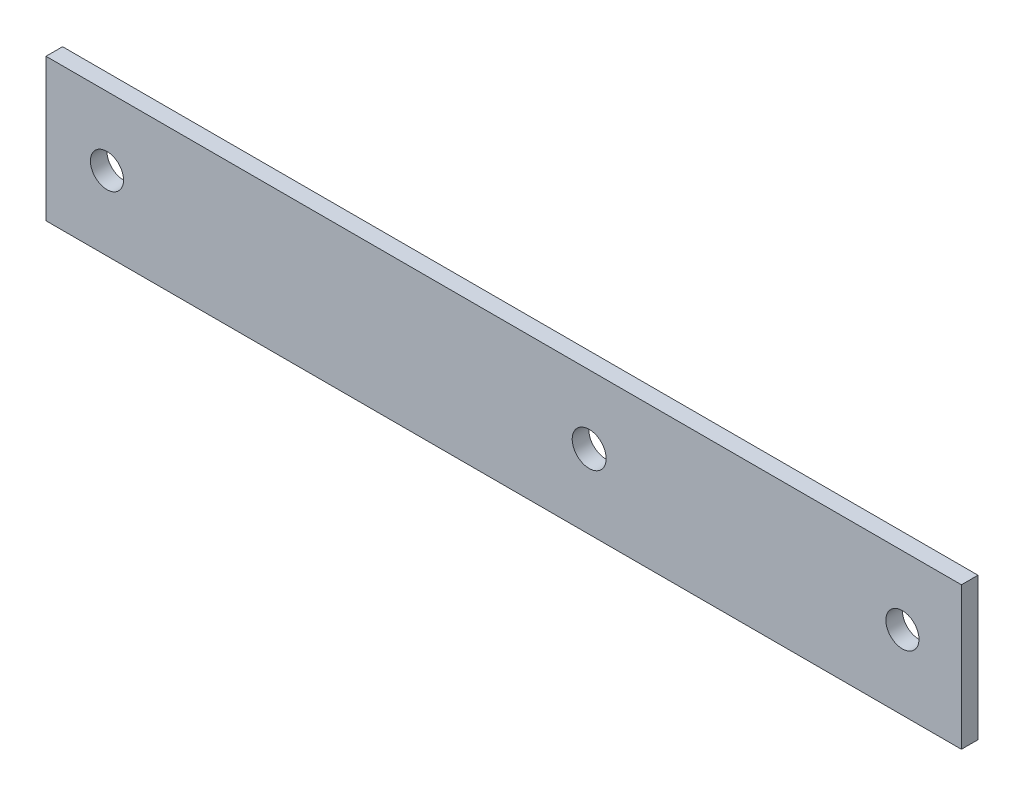
from build123d import *

# Parameters (mm, degrees)
SKETCH1_W           = 175.390705646
SKETCH1_H           = 27.302162023
SKETCH1_R           = 3.175
SKETCH1_R_2         = 3.2512
BOSS_EXTRUDE1_DEPTH = 3.175


with BuildPart() as part:
    # Sketch1 → Boss-Extrude1 (new body)
    with BuildSketch(Plane.XY):
        with Locations((152.213731171, -0.53297721)):
            Rectangle(SKETCH1_W, SKETCH1_H)
        with Locations((76.2, 0)):
            Circle(SKETCH1_R, mode=Mode.SUBTRACT)
        with Locations((228.6, 0)):
            Circle(SKETCH1_R, mode=Mode.SUBTRACT)
        with Locations((168.588523942, 0)):
            Circle(SKETCH1_R_2, mode=Mode.SUBTRACT)
    extrude(amount=BOSS_EXTRUDE1_DEPTH)


solid = part.part
